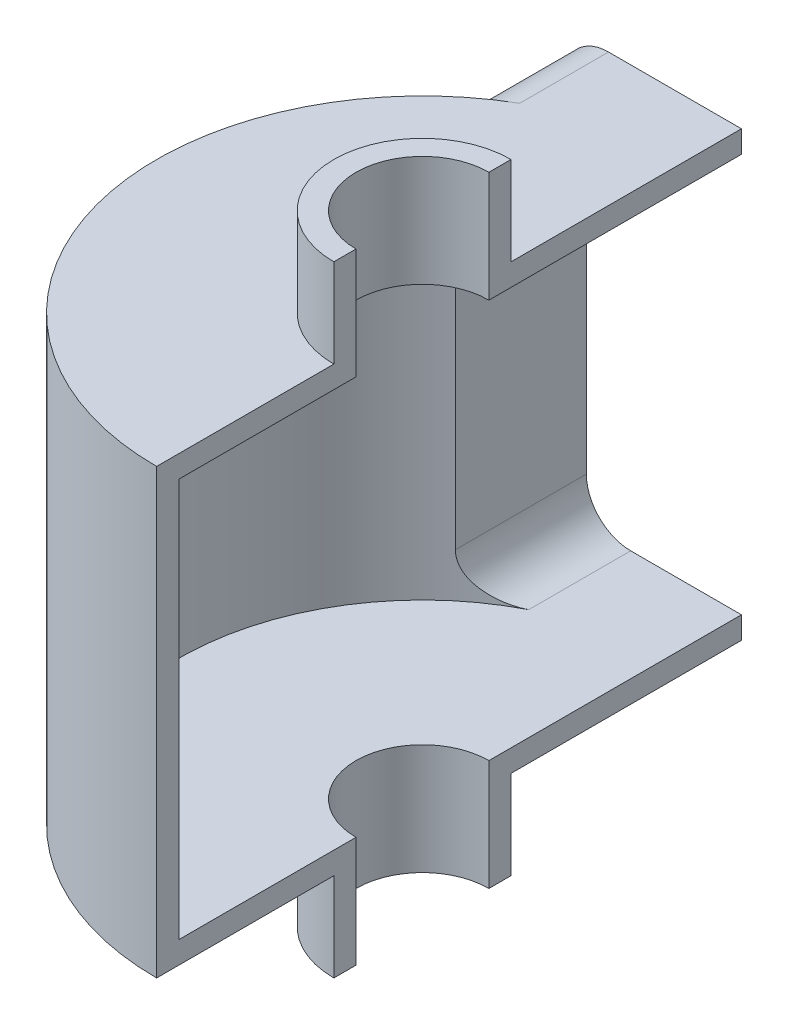
from build123d import *

# Parameters (mm, degrees)
DODANIE_WYCI_GNI_CIE1_DEPTH       = 25
DODANIE_WYCI_GNI_CIE2_DEPTH       = 5
WYCI_GNI_CIE_CIENKA_CIANKA1_REACH = 150.354
ZAOKR_GLENIE1_R                   = 10
ZAOKR_GLENIE2_R                   = 10
ZAOKR_GLENIE3_R                   = 10
ZAOKR_GLENIE4_R                   = 10


with BuildPart() as part:
    # Szkic1 → Dodanie-wyciągnięcie1 (new body)
    with BuildSketch(Plane(origin=(0, 0, 0), x_dir=(1, 0, 0), z_dir=(0, 1, 0))):
        with BuildLine():
            Line((0, 20), (0, 15))
            ThreePointArc((0, 15), (-15, 0), (0, -15))
            Line((0, -15), (0, -20))
            ThreePointArc((0, -20), (-20, 0), (0, 20))
        make_face()
    extrude(amount=DODANIE_WYCI_GNI_CIE1_DEPTH)

    # Szkic2 → Dodanie-wyciągnięcie2 (add)
    with BuildSketch(Plane(origin=(0, 0, 0), x_dir=(1, 0, 0), z_dir=(0, 1, 0))):
        with BuildLine():
            Line((0, 20), (0, 72))
            Line((0, 72), (-40, 72))
            Line((-40, 72), (-40, 44.72135955))
            ThreePointArc((-40, 44.72135955), (-56.050341538, -21.409325386), (0, -60))
            Line((0, -60), (0, -20))
            ThreePointArc((0, -20), (-20, 0), (0, 20))
        make_face()
    extrude(amount=DODANIE_WYCI_GNI_CIE2_DEPTH)


with BuildPart() as body_2:
    # Lustro3: mirrored copy
    add(part.part.mirror(Plane.ZX.offset(-45)))

    # Szkic3 → Wyciągnięcie-cienka ścianka1 (add, up to next)
    with BuildSketch(Plane(origin=(0, 0, 0), x_dir=(1, 0, 0), z_dir=(0, 1, 0)), mode=Mode.PRIVATE) as wyci_gni_cie_cienka_cianka1_sk1:
        with BuildLine():
            Line((-40, 72), (-40, 44.72135955))
            ThreePointArc((-40, 44.72135955), (-56.050341538, -21.409325386), (0, -60))
            Line((0, -60), (0, -55))
            ThreePointArc((0, -55), (-51.76124215, -18.594994247), (-35, 42.426406871))
            Line((-35, 42.426406871), (-35, 72))
            Line((-35, 72), (-40, 72))
        make_face()
    wyci_gni_cie_cienka_cianka1_tool1 = extrude(wyci_gni_cie_cienka_cianka1_sk1.sketch, amount=-WYCI_GNI_CIE_CIENKA_CIANKA1_REACH, mode=Mode.PRIVATE) - body_2.part

    add(part.part)  # Wyciągnięcie-cienka ścianka1 merges part
    add(wyci_gni_cie_cienka_cianka1_tool1.solids().sort_by_distance((-36.449966, 0, -57.213203))[0])

    # Zaokrąglenie1
    zaokr_glenie1_edges = [body_2.edges().sort_by_distance(p)[0] for p in [
        (-40, 5, -58.360679775),
    ]]
    fillet(zaokr_glenie1_edges, radius=ZAOKR_GLENIE1_R)

    # Zaokrąglenie2
    zaokr_glenie2_edges = [body_2.edges().sort_by_distance(p)[0] for p in [
        (-40, -95, -58.360679775),
    ]]
    fillet(zaokr_glenie2_edges, radius=ZAOKR_GLENIE2_R)

    # Zaokrąglenie3
    zaokr_glenie3_edges = [body_2.edges().sort_by_distance(p)[0] for p in [
        (-35, 0, -57.213203436),
    ]]
    fillet(zaokr_glenie3_edges, radius=ZAOKR_GLENIE3_R)

    # Zaokrąglenie4
    zaokr_glenie4_edges = [body_2.edges().sort_by_distance(p)[0] for p in [
        (-35, -90, -57.213203436),
    ]]
    fillet(zaokr_glenie4_edges, radius=ZAOKR_GLENIE4_R)


solid = body_2.part
